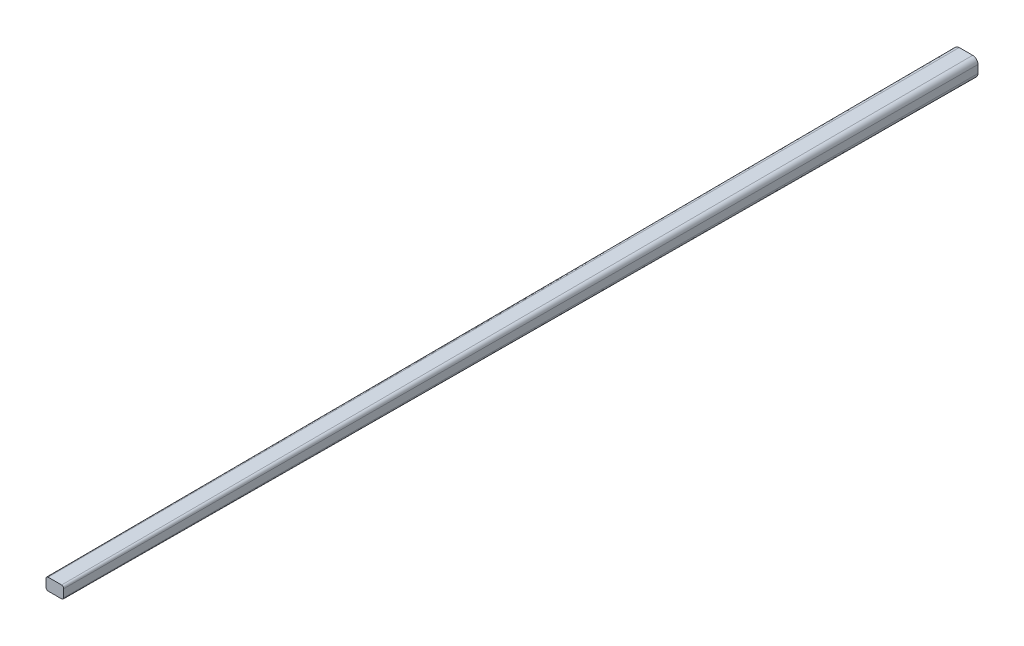
from build123d import *

# Parameters (mm, degrees)
BOSS_EXTRUDE1_DEPTH = 257
BOSS_EXTRUDE1_TAPER = 0.2


with BuildPart() as part:
    # Sketch1 → Boss-Extrude1 (new body)
    with BuildSketch(Plane.XY):
        with BuildLine():
            Line((-805.959430903, -1279.437202161), (-805.959430903, -1277.237202161))
            ThreePointArc((-805.959430903, -1277.237202161), (-806.398770731, -1276.176541989), (-807.459430903, -1275.737202161))
            Line((-807.459430903, -1275.737202161), (-811.259430903, -1275.737202161))
            ThreePointArc((-811.259430903, -1275.737202161), (-812.320091075, -1276.176541989), (-812.759430903, -1277.237202161))
            Line((-812.759430903, -1277.237202161), (-812.759430903, -1279.437202161))
            ThreePointArc((-812.759430903, -1279.437202161), (-812.320091075, -1280.497862332), (-811.259430903, -1280.937202161))
            Line((-811.259430903, -1280.937202161), (-807.459430903, -1280.937202161))
            ThreePointArc((-807.459430903, -1280.937202161), (-806.398770731, -1280.497862332), (-805.959430903, -1279.437202161))
        make_face()
    extrude(amount=BOSS_EXTRUDE1_DEPTH, taper=BOSS_EXTRUDE1_TAPER)


solid = part.part
